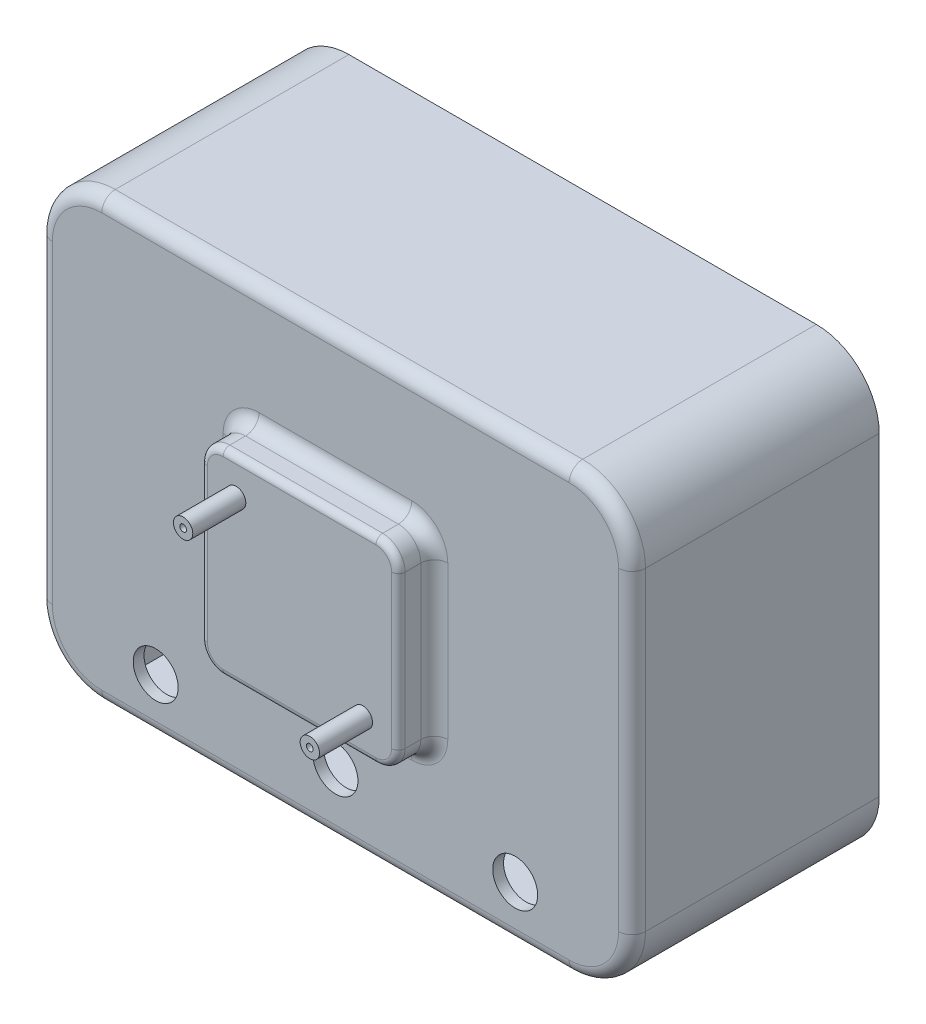
from build123d import *

# Parameters (mm, degrees)
SKETCH1_W           = 132
SKETCH1_H           = 98
BOSS_EXTRUDE1_DEPTH = 55
FILLET1_R           = 14
SKETCH7_R           = 6
BOSS_EXTRUDE2_DEPTH = 6
SKETCH8_R           = 2.25
CUT_EXTRUDE10_DEPTH = 6.2
SKETCH9_R           = 4
CUT_EXTRUDE11_DEPTH = 3
FILLET2_R           = 3
SKETCH10_W          = 44
SKETCH10_H          = 44
BOSS_EXTRUDE3_DEPTH = 8
FILLET3_R           = 5
FILLET4_R           = 1.5
SKETCH11_R          = 2.15
BOSS_EXTRUDE4_DEPTH = 11.8
SKETCH12_R          = 0.75
CUT_EXTRUDE12_DEPTH = 11.3
SKETCH13_R          = 5
CUT_EXTRUDE13_DEPTH = 3.2
FILLET5_R           = 3
SKETCH14_W          = 104
SKETCH14_H          = 92
CUT_EXTRUDE14_DEPTH = 52.6
SKETCH15_W          = 126
SKETCH15_H          = 70
CUT_EXTRUDE15_DEPTH = 52.6
SKETCH17_R          = 6.2
BOSS_EXTRUDE5_DEPTH = 6
SKETCH18_R          = 2.25
CUT_EXTRUDE17_DEPTH = 6.2
SKETCH19_R          = 4
CUT_EXTRUDE18_DEPTH = 3


with BuildPart() as part:
    # Sketch1 → Boss-Extrude1 (new body)
    with BuildSketch(Plane.XY):
        Rectangle(SKETCH1_W, SKETCH1_H)
    extrude(amount=BOSS_EXTRUDE1_DEPTH)

    # Fillet1
    fillet1_edges = [part.edges().sort_by_distance(p)[0] for p in [
        (-66, 49, 27.5),
        (66, 49, 27.5),
        (66, -49, 27.5),
        (-66, -49, 27.5),
    ]]
    fillet(fillet1_edges, radius=FILLET1_R)

    # Sketch7 → Boss-Extrude2 (add)
    with BuildSketch(Plane.XY):
        with Locations((-27.75, -42.789)):
            Circle(SKETCH7_R)
        with Locations((27.75, -42.789)):
            Circle(SKETCH7_R)
        with Locations((-27.75, 42.789)):
            Circle(SKETCH7_R)
        with Locations((27.75, 42.789)):
            Circle(SKETCH7_R)
    extrude(amount=BOSS_EXTRUDE2_DEPTH)

    # Sketch8 → Cut-Extrude10 (cut)
    with BuildSketch(Plane.XY.offset(6)):
        with Locations((-27.75, -42.789)):
            Circle(SKETCH8_R)
        with Locations((27.75, -42.789)):
            Circle(SKETCH8_R)
        with Locations((-27.75, 42.789)):
            Circle(SKETCH8_R)
        with Locations((27.75, 42.789)):
            Circle(SKETCH8_R)
    extrude(amount=-CUT_EXTRUDE10_DEPTH, mode=Mode.SUBTRACT)

    # Sketch9 → Cut-Extrude11 (cut)
    with BuildSketch(Plane.XY.offset(6)):
        with Locations((-27.75, -42.789)):
            Circle(SKETCH9_R)
        with Locations((27.75, -42.789)):
            Circle(SKETCH9_R)
        with Locations((-27.75, 42.789)):
            Circle(SKETCH9_R)
        with Locations((27.75, 42.789)):
            Circle(SKETCH9_R)
    extrude(amount=-CUT_EXTRUDE11_DEPTH, mode=Mode.SUBTRACT)

    # Fillet2
    fillet2_edges = [part.edges().sort_by_distance(p)[0] for p in [
        (-66, 0, 55),
        (0, 49, 55),
        (0, -49, 55),
        (66, 0, 55),
        (-61.899494937, -44.899494937, 55),
        (61.899494937, -44.899494937, 55),
        (61.899494937, 44.899494937, 55),
        (-61.899494937, 44.899494937, 55),
    ]]
    fillet(fillet2_edges, radius=FILLET2_R)

    # Sketch10 → Boss-Extrude3 (add)
    with BuildSketch(Plane.XY.offset(55)):
        Rectangle(SKETCH10_W, SKETCH10_H)
    extrude(amount=BOSS_EXTRUDE3_DEPTH)

    # Fillet3
    fillet3_edges = [part.edges().sort_by_distance(p)[0] for p in [
        (-22, 22, 59),
        (-22, -22, 59),
        (22, -22, 59),
        (22, 22, 59),
    ]]
    fillet(fillet3_edges, radius=FILLET3_R)

    # Fillet4
    fillet4_edges = [part.edges().sort_by_distance(p)[0] for p in [
        (-22, 0, 63),
        (0, 22, 63),
        (0, -22, 63),
        (22, 0, 63),
        (-20.535533906, -20.535533906, 63),
        (20.535533906, -20.535533906, 63),
        (20.535533906, 20.535533906, 63),
        (-20.535533906, 20.535533906, 63),
    ]]
    fillet(fillet4_edges, radius=FILLET4_R)

    # Sketch11 → Boss-Extrude4 (add)
    with BuildSketch(Plane.XY.offset(63)):
        with Locations(Location((-14.1, 14.1, 0), (0, 0, 180))):
            Circle(SKETCH11_R)
        with Locations(Location((14.1, -14.1, 0), (0, 0, 180))):
            Circle(SKETCH11_R)
    extrude(amount=BOSS_EXTRUDE4_DEPTH)

    # Sketch12 → Cut-Extrude12 (cut)
    with BuildSketch(Plane.XY.offset(74.8)):
        with Locations((-14.1, 14.1)):
            Circle(SKETCH12_R)
        with Locations((14.1, -14.1)):
            Circle(SKETCH12_R)
    extrude(amount=-CUT_EXTRUDE12_DEPTH, mode=Mode.SUBTRACT)

    # Sketch13 → Cut-Extrude13 (cut)
    with BuildSketch(Plane.XY.offset(55)):
        with Locations((-40, -37)):
            Circle(SKETCH13_R)
        with Locations((40, -37)):
            Circle(SKETCH13_R)
        with Locations((0, -35)):
            Circle(SKETCH13_R)
    extrude(amount=-CUT_EXTRUDE13_DEPTH, mode=Mode.SUBTRACT)

    # Fillet5
    fillet5_edges = [part.edges().sort_by_distance(p)[0] for p in [
        (-22, 0, 55),
        (0, 22, 55),
        (22, 0, 55),
        (0, -22, 55),
        (-20.535533906, 20.535533906, 55),
        (20.535533906, 20.535533906, 55),
        (20.535533906, -20.535533906, 55),
        (-20.535533906, -20.535533906, 55),
    ]]
    fillet(fillet5_edges, radius=FILLET5_R)

    # Sketch14 → Cut-Extrude14 (cut)
    with BuildSketch(Plane(origin=(0, 0, 0), x_dir=(-1, 0, 0), z_dir=(0, 0, -1))):
        Rectangle(SKETCH14_W, SKETCH14_H)
    extrude(amount=-CUT_EXTRUDE14_DEPTH, mode=Mode.SUBTRACT)

    # Sketch15 → Cut-Extrude15 (cut)
    with BuildSketch(Plane(origin=(0, 0, 0), x_dir=(-1, 0, 0), z_dir=(0, 0, -1))):
        Rectangle(SKETCH15_W, SKETCH15_H)
    extrude(amount=-CUT_EXTRUDE15_DEPTH, mode=Mode.SUBTRACT)

    # Sketch17 → Boss-Extrude5 (add)
    with BuildSketch(Plane.XY):
        with Locations((-27.75, -42.789)):
            Circle(SKETCH17_R)
        with Locations((27.75, -42.789)):
            Circle(SKETCH17_R)
        with Locations((-27.75, 42.789)):
            Circle(SKETCH17_R)
        with Locations((27.75, 42.789)):
            Circle(SKETCH17_R)
    extrude(amount=BOSS_EXTRUDE5_DEPTH)

    # Sketch18 → Cut-Extrude17 (cut)
    with BuildSketch(Plane.XY.offset(6)):
        with Locations((-27.75, -42.789)):
            Circle(SKETCH18_R)
        with Locations((27.75, -42.789)):
            Circle(SKETCH18_R)
        with Locations((-27.75, 42.789)):
            Circle(SKETCH18_R)
        with Locations((27.75, 42.789)):
            Circle(SKETCH18_R)
    extrude(amount=-CUT_EXTRUDE17_DEPTH, mode=Mode.SUBTRACT)

    # Sketch19 → Cut-Extrude18 (cut)
    with BuildSketch(Plane.XY.offset(6)):
        with Locations((-27.75, -42.789)):
            Circle(SKETCH19_R)
        with Locations((27.75, -42.789)):
            Circle(SKETCH19_R)
        with Locations((-27.75, 42.789)):
            Circle(SKETCH19_R)
        with Locations((27.75, 42.789)):
            Circle(SKETCH19_R)
    extrude(amount=-CUT_EXTRUDE18_DEPTH, mode=Mode.SUBTRACT)


solid = part.part
